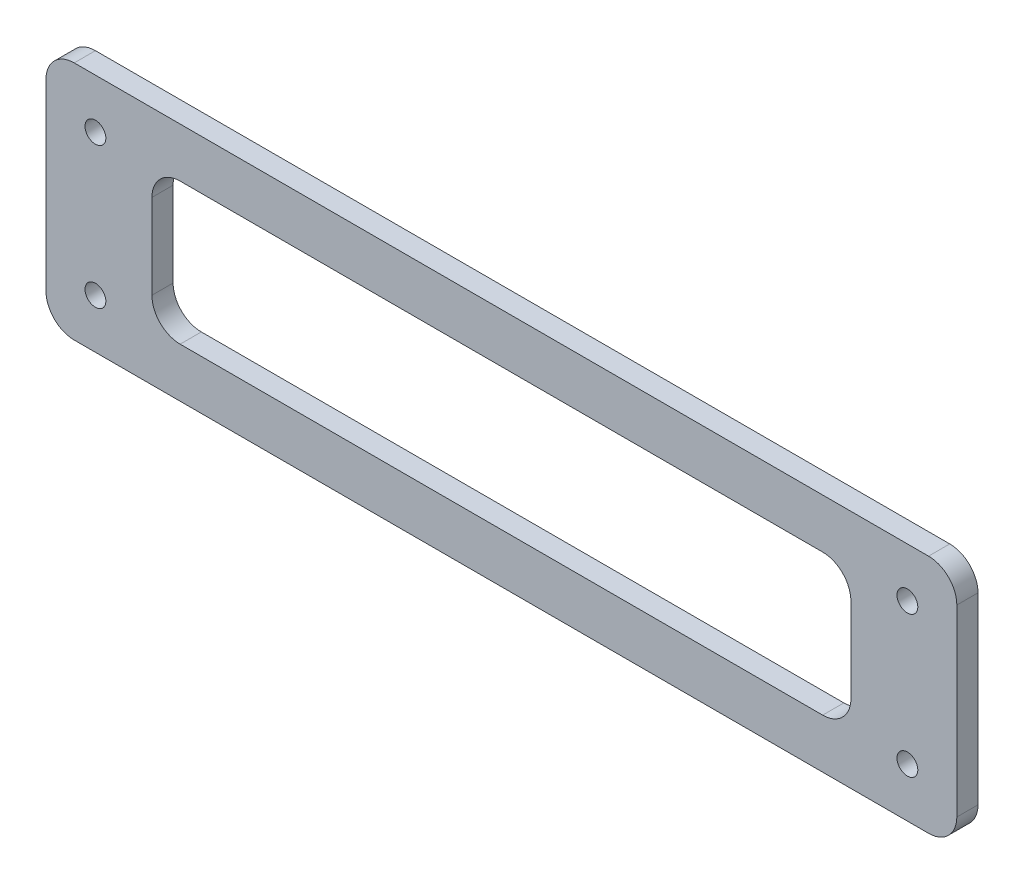
from build123d import *

# Parameters (mm, degrees)
SKETCH_1_W      = 129
SKETCH_1_H      = 34
SKETCH_1_R      = 1.475
SKETCH_1_W_2    = 99
SKETCH_1_H_2    = 20
EXTRUDE_1_DEPTH = 3
FILLET_1_R      = 4


with BuildPart() as part:
    # 草图1 → 凸台-拉伸1 (new body)
    with BuildSketch(Plane.XY):
        Rectangle(SKETCH_1_W, SKETCH_1_H)
        with Locations((-57.5, 10)):
            Circle(SKETCH_1_R, mode=Mode.SUBTRACT)
        with Locations((-57.5, -10)):
            Circle(SKETCH_1_R, mode=Mode.SUBTRACT)
        with Locations(Location((57.5, -10, 0), (0, 0, 180))):
            Circle(SKETCH_1_R, mode=Mode.SUBTRACT)
        with Locations(Location((57.5, 10, 0), (0, 0, 180))):
            Circle(SKETCH_1_R, mode=Mode.SUBTRACT)
        Rectangle(SKETCH_1_W_2, SKETCH_1_H_2, mode=Mode.SUBTRACT)
    extrude(amount=EXTRUDE_1_DEPTH)

    # 圆角1
    fillet_1_edges = [part.edges().sort_by_distance(p)[0] for p in [
        (49.5, -10, 1.5),
        (49.5, 10, 1.5),
        (-49.5, 10, 1.5),
        (-49.5, -10, 1.5),
        (64.5, -17, 1.5),
        (-64.5, -17, 1.5),
        (-64.5, 17, 1.5),
        (64.5, 17, 1.5),
    ]]
    fillet(fillet_1_edges, radius=FILLET_1_R)


solid = part.part
